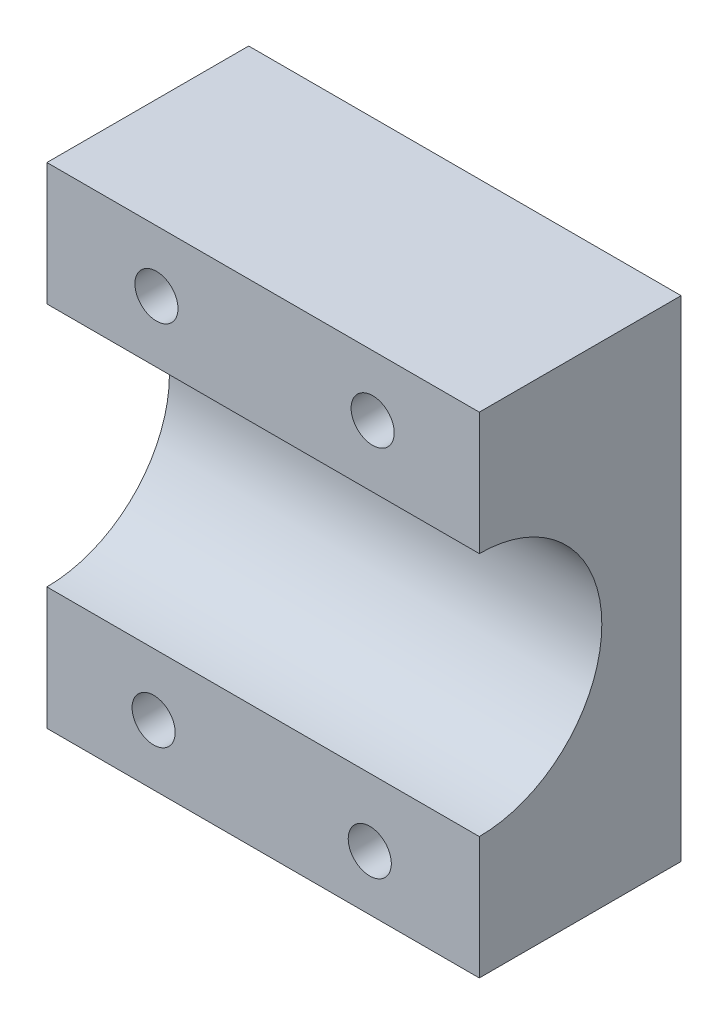
from build123d import *

# Parameters (mm, degrees)
SKETCH1_W                                           = 38.1
SKETCH1_H                                           = 43.18
BOSS_EXTRUDE1_DEPTH                                 = 17.78
SKETCH2_R                                           = 10.795
CUT_EXTRUDE1_DEPTH                                  = 61.26815743
CBORE_FOR_6_BINDING_HEAD_MACHINE_SCREW1_D           = 3.7973
CBORE_FOR_6_BINDING_HEAD_MACHINE_SCREW1_CBORE_D     = 7.9375
CBORE_FOR_6_BINDING_HEAD_MACHINE_SCREW1_CBORE_DEPTH = 2.2098


with BuildPart() as part:
    # Sketch1 → Boss-Extrude1 (new body)
    with BuildSketch(Plane.XY):
        with Locations((19.05, 21.59)):
            Rectangle(SKETCH1_W, SKETCH1_H)
    extrude(amount=BOSS_EXTRUDE1_DEPTH)

    # Sketch2 → Cut-Extrude1 (cut, through all)
    with BuildSketch(Plane.ZY):
        with Locations((17.78, 21.59)):
            Circle(SKETCH2_R)
    extrude(amount=-CUT_EXTRUDE1_DEPTH, mode=Mode.SUBTRACT)

    # CBORE for #6 Binding Head Machine Screw1 (through all)
    with Locations(Plane(origin=(28.701956409, 37.846, 0), x_dir=(-1, 0, 0), z_dir=(0, 0, -1))):
        with Locations((0, 0), (19.049956409, -0.040753052), (0.253956409, -32.99093936), (19.297934909, -32.512)):
            CounterBoreHole(CBORE_FOR_6_BINDING_HEAD_MACHINE_SCREW1_D / 2, CBORE_FOR_6_BINDING_HEAD_MACHINE_SCREW1_CBORE_D / 2, CBORE_FOR_6_BINDING_HEAD_MACHINE_SCREW1_CBORE_DEPTH)


solid = part.part
